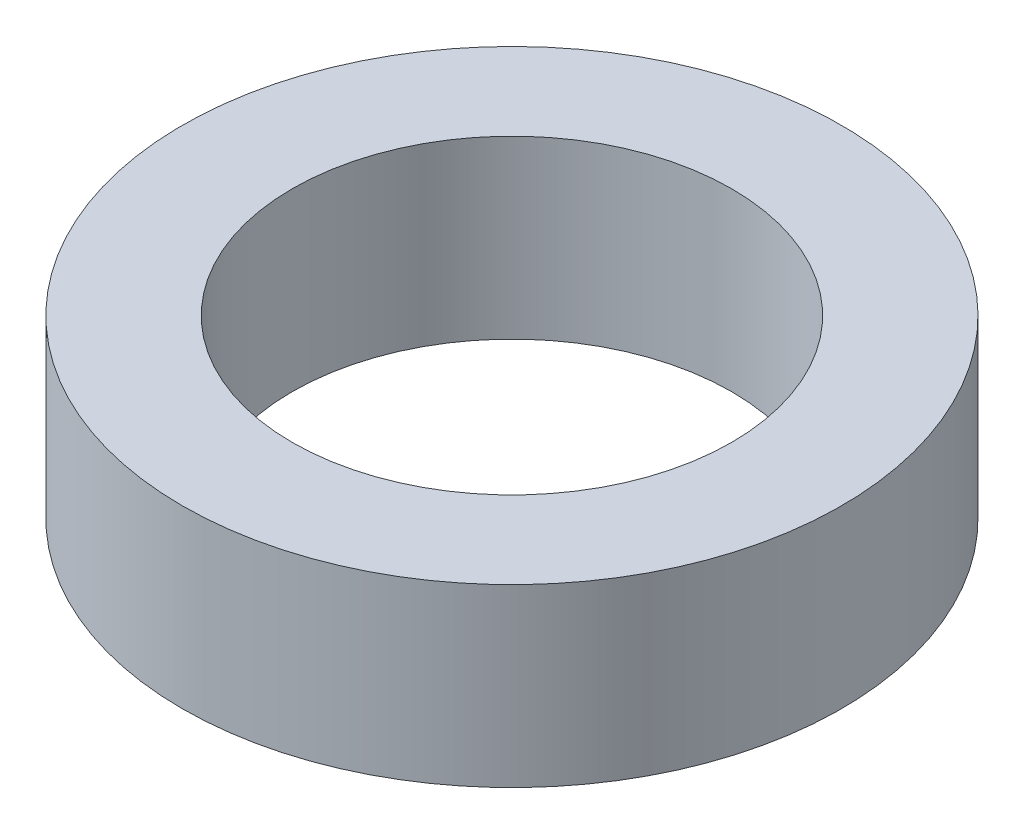
from build123d import *

# Parameters (mm, degrees)
SKETCH4_R           = 7.5
SKETCH4_R_2         = 5
BOSS_EXTRUDE4_DEPTH = 4


with BuildPart() as part:
    # Sketch4 → Boss-Extrude4 (new body)
    with BuildSketch(Plane(origin=(0, 0, 0), x_dir=(1, 0, 0), z_dir=(0, 1, 0))):
        with Locations(Location((0, 0, 0), (0, 0, 270))):
            Circle(SKETCH4_R)
        with Locations(Location((0, 0, 0), (0, 0, 270))):
            Circle(SKETCH4_R_2, mode=Mode.SUBTRACT)
    extrude(amount=BOSS_EXTRUDE4_DEPTH)


solid = part.part
